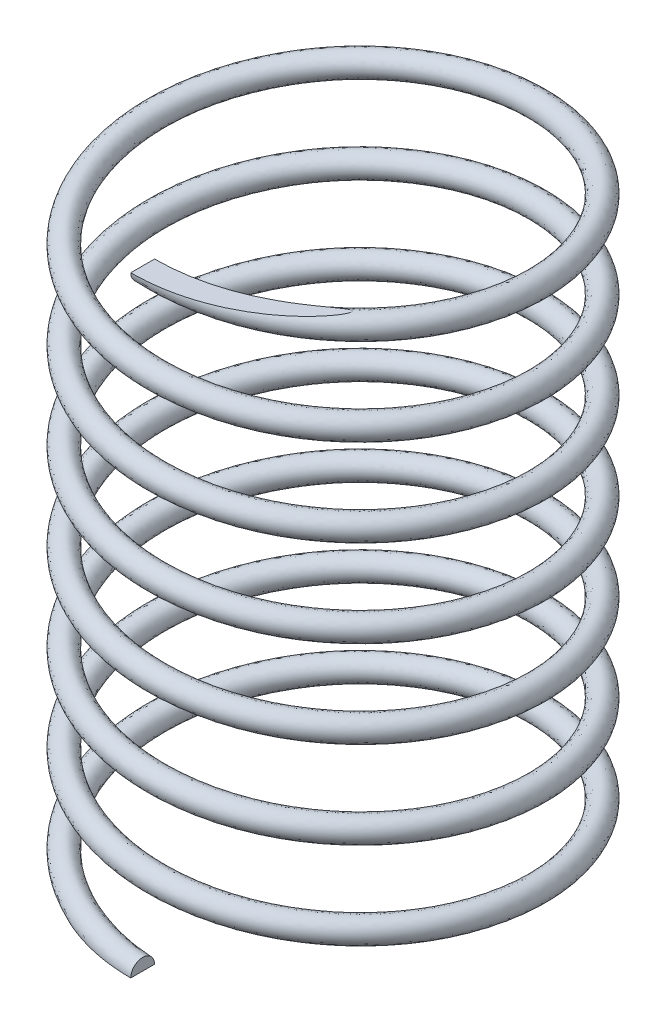
from build123d import *

# Parameters (mm, degrees)
WYCI_GNI_CIE_PO_CIE_CE2_PITCH   = 2.75
WYCI_GNI_CIE_PO_CIE_CE2_HEIGHT  = 19.25
WYCI_GNI_CIE_PO_CIE_CE2_RADIUS  = 6
SZKIC5_R                        = 0.375
WYTNIJ_WYCI_GNI_CIE1_DEPTH      = 22.596810022
WYTNIJ_WYCI_GNI_CIE1_DEPTH_BACK = 22.596810022
SZKIC12_W                       = 31.402569525
SZKIC12_H                       = 3.102846983
SZKIC12_W_2                     = 33.650246462


with BuildPart() as part:
    # Wyciągnięcie po ścieżce2: sweep along a helix
    with BuildLine() as wyci_gni_cie_po_cie_ce2_path:
        Helix(WYCI_GNI_CIE_PO_CIE_CE2_PITCH, WYCI_GNI_CIE_PO_CIE_CE2_HEIGHT, WYCI_GNI_CIE_PO_CIE_CE2_RADIUS, center=(0, 0, 0), direction=(0, 1, 0), lefthand=True)
    # Szkic5 → Wyciągnięcie po ścieżce2 (sweep)
    with BuildSketch(Plane(origin=(0, 0, 0), x_dir=(0, 0, -1), z_dir=(1, 0, 0))):
        with Locations((-6, 0)):
            Circle(SZKIC5_R)
    sweep(path=wyci_gni_cie_po_cie_ce2_path.line, is_frenet=True)

    # Szkic12 → Wytnij-wyciągnięcie1 (cut, two sides: drawn at the far end of the back side and taken through both)
    with BuildSketch(Plane(origin=(0, 0, 0), x_dir=(0, 0, -1), z_dir=(1, 0, 0)).offset(-WYTNIJ_WYCI_GNI_CIE1_DEPTH_BACK)):
        with Locations((9.326284763, -1.551423492)):
            Rectangle(SZKIC12_W, SZKIC12_H)
        with Locations((-2.48093164, 20.801423492)):
            Rectangle(SZKIC12_W_2, SZKIC12_H)
    extrude(amount=WYTNIJ_WYCI_GNI_CIE1_DEPTH + WYTNIJ_WYCI_GNI_CIE1_DEPTH_BACK, mode=Mode.SUBTRACT)


solid = part.part
